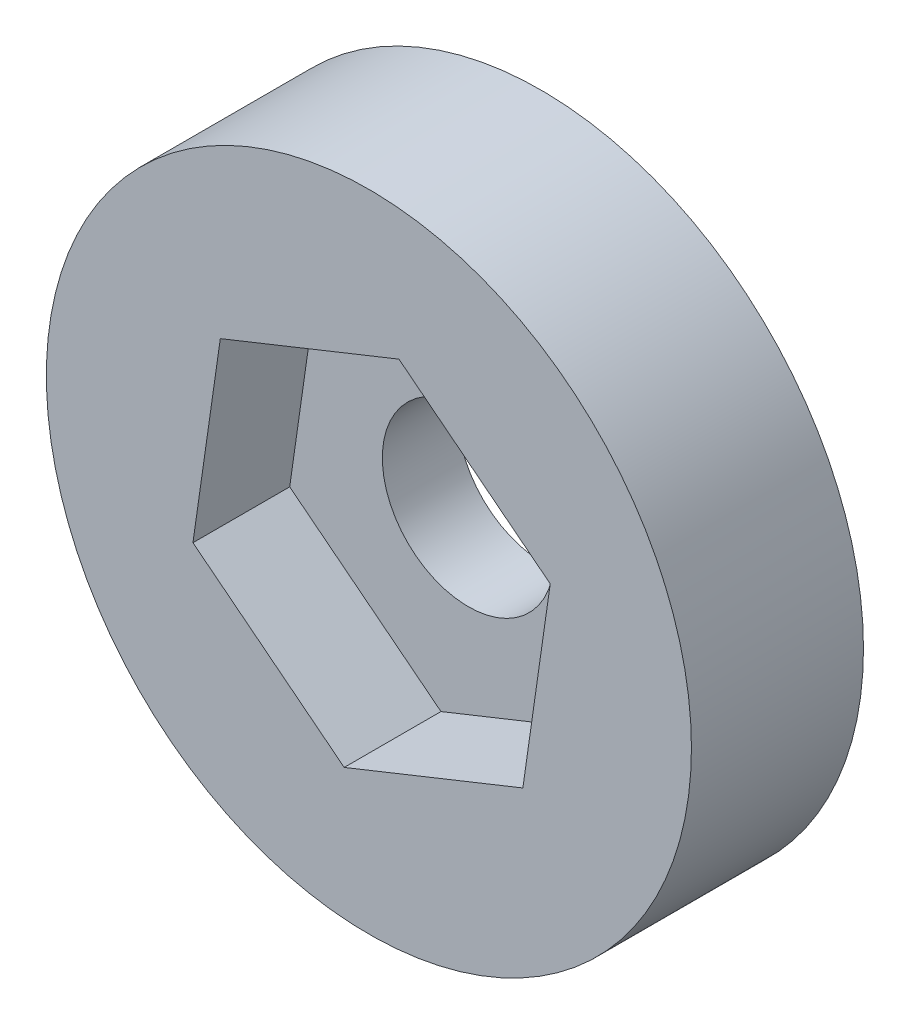
from build123d import *

# Parameters (mm, degrees)
SKETCH1_R           = 6
BOSS_EXTRUDE1_DEPTH = 3.2
CUT_EXTRUDE1_DEPTH  = 1.8
SKETCH3_R           = 1.6
CUT_EXTRUDE2_DEPTH  = 3.8


with BuildPart() as part:
    # Sketch1 → Boss-Extrude1 (new body)
    with BuildSketch(Plane.XY):
        with Locations((58.8, 0)):
            Circle(SKETCH1_R)
    extrude(amount=BOSS_EXTRUDE1_DEPTH)

    # Sketch2 → Cut-Extrude1 (cut)
    with BuildSketch(Plane.XY.offset(3.2)):
        Polygon((59.35924592, 3.543162701), (56.036154051, 2.212601254), (55.526908131, -1.330561447), (58.34075408, -3.543162701), (61.663845949, -2.212601254), (62.173091869, 1.330561447), align=None)
    extrude(amount=-CUT_EXTRUDE1_DEPTH, mode=Mode.SUBTRACT)

    # Sketch3 → Cut-Extrude2 (cut)
    with BuildSketch(Plane.XY.offset(1.4)):
        with Locations((58.85, 0)):
            Circle(SKETCH3_R)
    extrude(amount=-CUT_EXTRUDE2_DEPTH, mode=Mode.SUBTRACT)


solid = part.part
